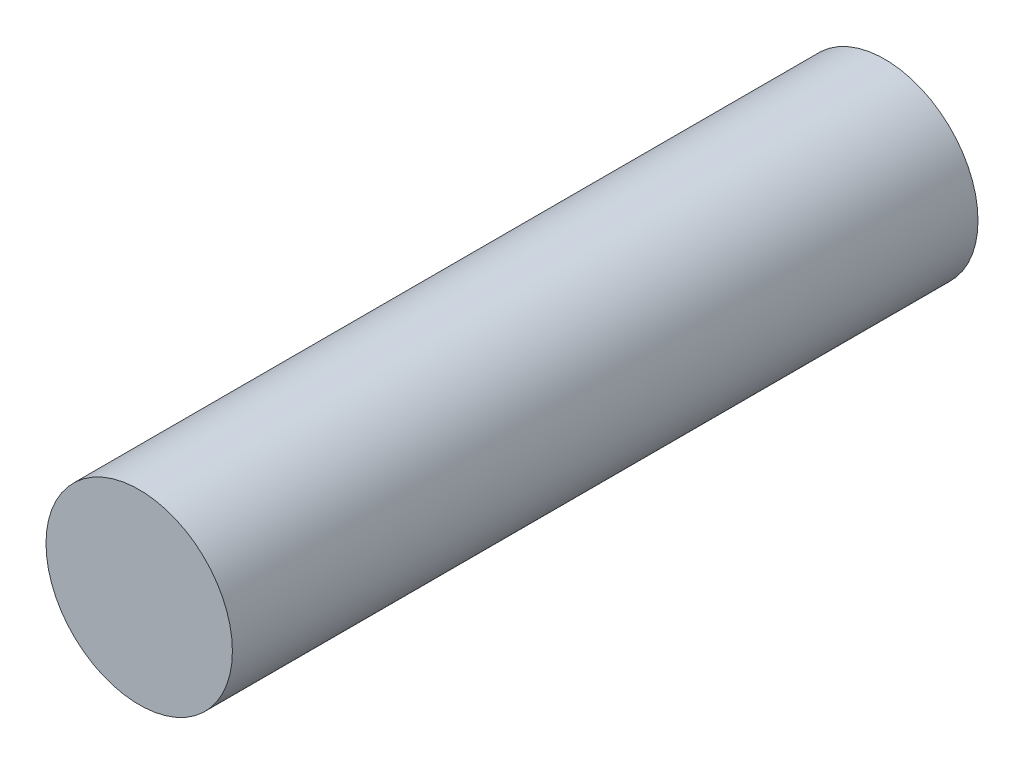
from build123d import *

# Parameters (mm, degrees)
PROFILE1_R = 5


with BuildPart() as part:
    # sweep_merge_false: sweep along a path in Path1
    with BuildLine(Plane(origin=(0, 0, 0), x_dir=(0, 0, -1), z_dir=(1, 0, 0))) as sweep_merge_false_path:
        Line((0, 0), (-40, 0))
    # Profile1 → sweep_merge_false (sweep)
    with BuildSketch(Plane.XY):
        Circle(PROFILE1_R)
    sweep(path=sweep_merge_false_path.line)


solid = part.part
